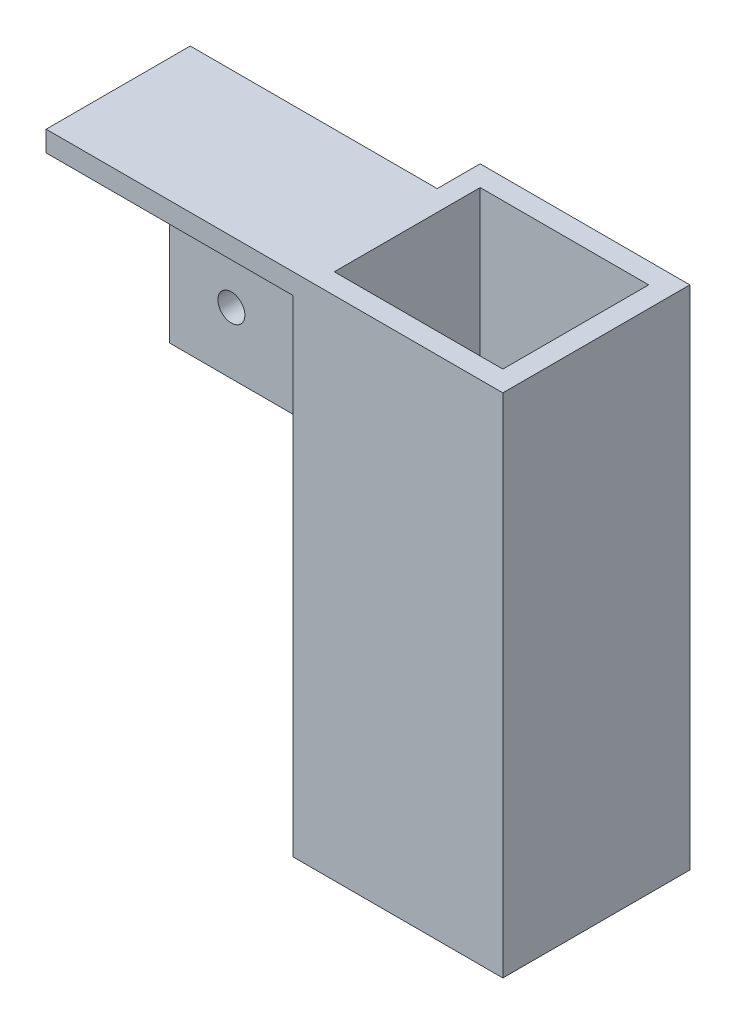
from build123d import *

# Parameters (mm, degrees)
SKETCH1_W           = 76.2
SKETCH1_H           = 38.1
BOSS_EXTRUDE1_DEPTH = 6.35
SKETCH2_W           = 76.2
SKETCH2_H           = 76.2
SKETCH2_R           = 4.1656
BOSS_EXTRUDE2_DEPTH = 6.35
SKETCH3_W           = 64.7
SKETCH3_H           = 57.7
SKETCH3_W_2         = 52
SKETCH3_H_2         = 45
BOSS_EXTRUDE3_DEPTH = 150
SKETCH4_W           = 64.7
SKETCH4_H           = 57.7
BOSS_EXTRUDE4_DEPTH = 6.35


with BuildPart() as part:
    # Sketch1 → Boss-Extrude1 (new body)
    with BuildSketch(Plane(origin=(0, 0, 0), x_dir=(1, 0, 0), z_dir=(0, 1, 0))):
        Rectangle(SKETCH1_W, SKETCH1_H)
    extrude(amount=BOSS_EXTRUDE1_DEPTH)

    # Sketch2 → Boss-Extrude2 (add)
    with BuildSketch(Plane(origin=(0, 0, -19.05), x_dir=(-1, 0, 0), z_dir=(0, 0, -1))):
        with Locations((0, -31.75)):
            Rectangle(SKETCH2_W, SKETCH2_H)
        with Locations((-19.05, -12.7)):
            Circle(SKETCH2_R, mode=Mode.SUBTRACT)
        with Locations((19.05, -12.7)):
            Circle(SKETCH2_R, mode=Mode.SUBTRACT)
        with Locations((19.05, -50.8)):
            Circle(SKETCH2_R, mode=Mode.SUBTRACT)
        with Locations((-19.05, -50.8)):
            Circle(SKETCH2_R, mode=Mode.SUBTRACT)
    extrude(amount=BOSS_EXTRUDE2_DEPTH)

    # Sketch3 → Boss-Extrude3 (add)
    with BuildSketch(Plane(origin=(0, 6.35, 0), x_dir=(1, 0, 0), z_dir=(0, 1, 0))):
        with Locations((70.45, 9.8)):
            Rectangle(SKETCH3_W, SKETCH3_H)
        with Locations((70.45, 9.8)):
            Rectangle(SKETCH3_W_2, SKETCH3_H_2, mode=Mode.SUBTRACT)
    extrude(amount=-BOSS_EXTRUDE3_DEPTH)

    # Sketch4 → Boss-Extrude4 (add)
    with BuildSketch(Plane.XZ.offset(143.65)):
        with Locations((70.45, -9.8)):
            Rectangle(SKETCH4_W, SKETCH4_H)
    extrude(amount=BOSS_EXTRUDE4_DEPTH)


solid = part.part
